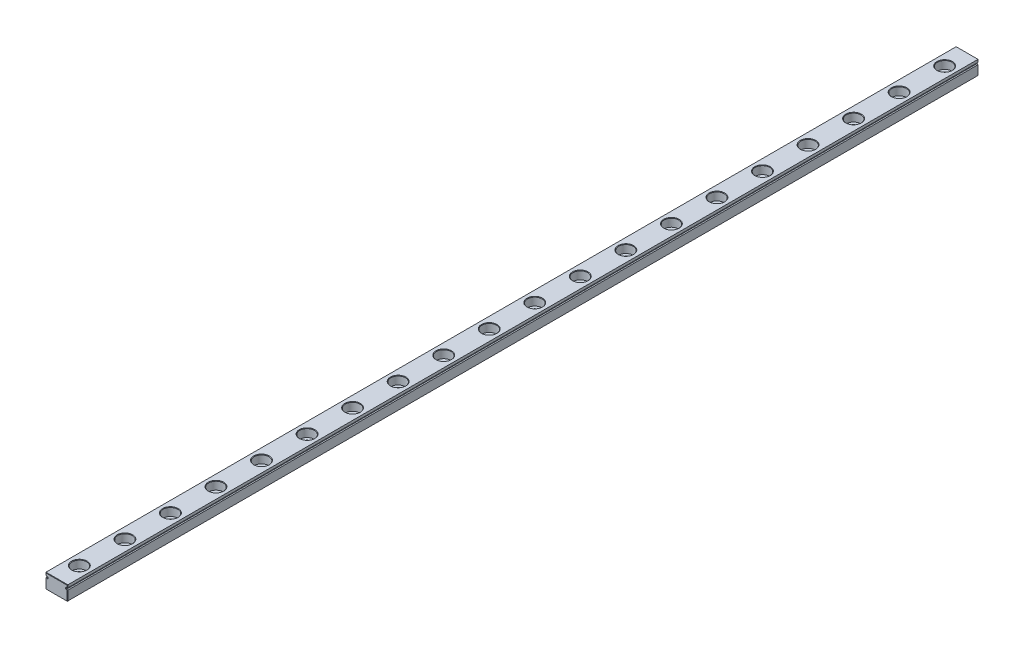
from build123d import *

# Parameters (mm, degrees)
BOSS_EXTRUDE1_DEPTH = 500
CHAMFER1_SIZE       = 0.2
LPATTERN1_COUNT     = 20
LPATTERN1_PITCH     = 25


with BuildPart() as part:
    # Sketch1 → Boss-Extrude1 (new body)
    with BuildSketch(Plane.XY):
        with BuildLine():
            Line((12.21524152, 8.978261926), (12.21524152, 7.53727892))
            ThreePointArc((12.21524152, 7.53727892), (11.921348894, 7.453790184), (11.71524152, 7.228261926))
            Line((11.71524152, 7.228261926), (11.21524152, 7.228261926))
            Line((11.21524152, 7.228261926), (11.21524152, 6.728261926))
            Line((11.21524152, 6.728261926), (11.71524152, 6.728261926))
            ThreePointArc((11.71524152, 6.728261926), (11.921348894, 6.502733668), (12.21524152, 6.419244931))
            Line((12.21524152, 6.419244931), (12.21524152, 1.278261926))
            Line((12.21524152, 1.278261926), (11.91524152, 0.978261926))
            Line((11.91524152, 0.978261926), (0.51524152, 0.978261926))
            Line((0.51524152, 0.978261926), (0.21524152, 1.278261926))
            Line((0.21524152, 1.278261926), (0.21524152, 6.419244931))
            ThreePointArc((0.21524152, 6.419244931), (0.509134147, 6.502733668), (0.71524152, 6.728261926))
            Line((0.71524152, 6.728261926), (1.21524152, 6.728261926))
            Line((1.21524152, 6.728261926), (1.21524152, 7.228261926))
            Line((1.21524152, 7.228261926), (0.71524152, 7.228261926))
            ThreePointArc((0.71524152, 7.228261926), (0.509134147, 7.453790184), (0.21524152, 7.53727892))
            Line((0.21524152, 7.53727892), (0.21524152, 8.978261926))
            Line((0.21524152, 8.978261926), (12.21524152, 8.978261926))
        make_face()
    extrude(amount=-BOSS_EXTRUDE1_DEPTH)

    # Chamfer1
    chamfer1_edges = [part.edges().sort_by_distance(p)[0] for p in [
        (0.509134147, 7.453790184, -500),
        (0.96524152, 7.228261926, -500),
        (12.21524152, 8.257770423, 0),
        (1.21524152, 6.978261926, -500),
        (11.921348894, 7.453790184, 0),
        (11.46524152, 7.228261926, 0),
        (11.21524152, 6.978261926, 0),
        (11.46524152, 6.728261926, 0),
        (11.921348894, 6.502733668, 0),
        (12.21524152, 3.848753429, 0),
        (12.06524152, 1.128261926, 0),
        (6.21524152, 0.978261926, 0),
        (0.96524152, 6.728261926, -500),
        (0.36524152, 1.128261926, 0),
        (0.21524152, 3.848753429, 0),
        (0.509134147, 6.502733668, 0),
        (0.96524152, 6.728261926, 0),
        (1.21524152, 6.978261926, 0),
        (0.96524152, 7.228261926, 0),
        (0.509134147, 7.453790184, 0),
        (0.509134147, 6.502733668, -500),
        (0.21524152, 8.257770423, 0),
        (6.21524152, 8.978261926, 0),
        (0.21524152, 3.848753429, -500),
        (0.36524152, 1.128261926, -500),
        (6.21524152, 0.978261926, -500),
        (12.06524152, 1.128261926, -500),
        (12.21524152, 3.848753429, -500),
        (6.21524152, 8.978261926, -500),
        (11.921348894, 6.502733668, -500),
        (11.46524152, 6.728261926, -500),
        (11.21524152, 6.978261926, -500),
        (11.46524152, 7.228261926, -500),
        (11.921348894, 7.453790184, -500),
        (12.21524152, 8.257770423, -500),
        (0.21524152, 8.257770423, -500),
    ]]
    chamfer(chamfer1_edges, length=CHAMFER1_SIZE)

    # Sketch3 → CBORE for M4 Hex Head Machine Screw1 (revolve, cut)
    with BuildSketch(Plane(origin=(6.21524152, 8.978261926, -12.5), x_dir=(0, 0, 1), z_dir=(1, 0, 0))):
        Polygon((0, 0), (0, 8), (2.25, 8), (2.25, 4.5), (4, 4.5), (4, 0.25), (4.25, 0), align=None)
    cbore_for_m4_hex_head_machine_screw1 = revolve(axis=Axis((6.21524152, 15.328261926, -12.5), (0, -1, 0)), mode=Mode.SUBTRACT)

    # LPattern1: CBORE for M4 Hex Head Machine Screw1 ×20
    with Locations(*[(0, 0, -i * LPATTERN1_PITCH) for i in range(1, LPATTERN1_COUNT)]):
        add(cbore_for_m4_hex_head_machine_screw1, mode=Mode.SUBTRACT)


solid = part.part
